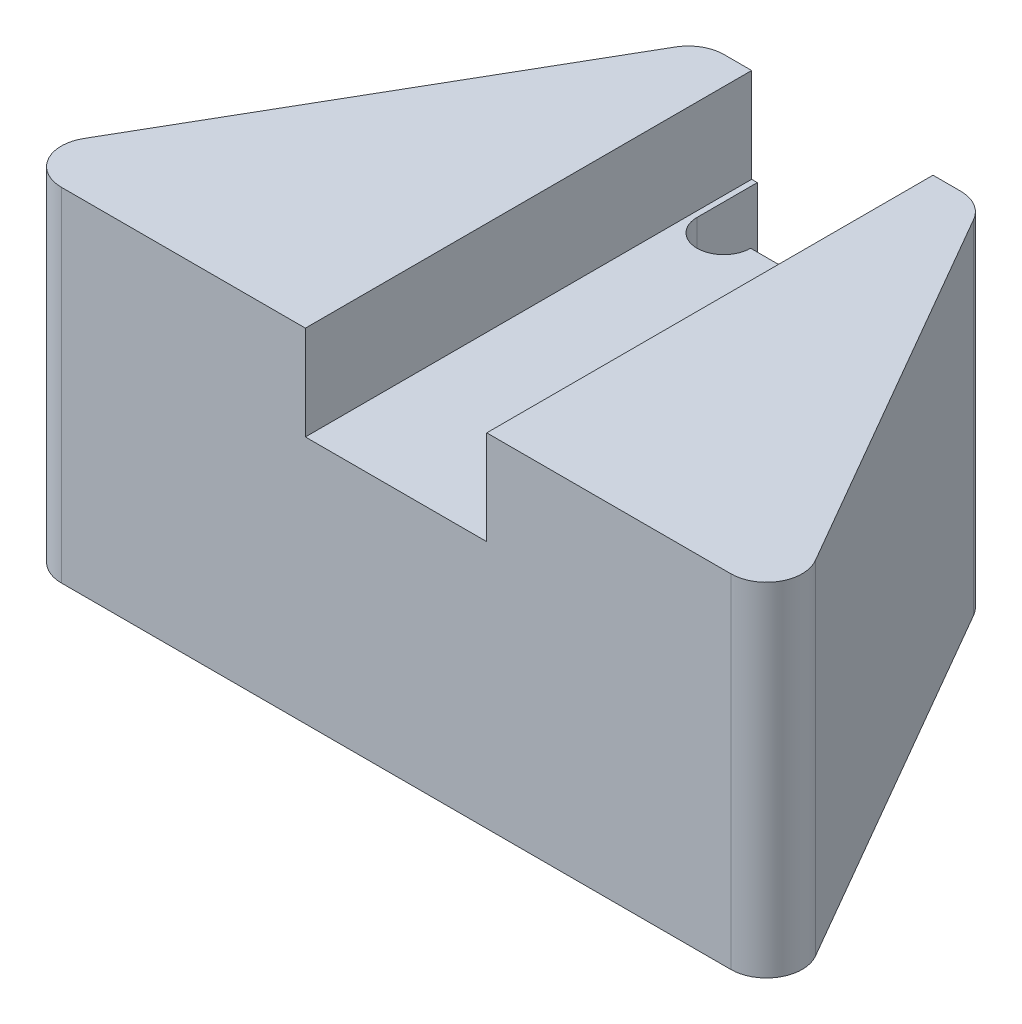
from build123d import *

# Parameters (mm, degrees)
BOSS_EXTRUDE1_DEPTH = 9.6
FILLET5_R           = 2
SKETCH7_W           = 10.16
SKETCH7_H           = 5.28
CUT_EXTRUDE6_DEPTH  = 34.879754173
SKETCH11_W          = 9.525
SKETCH11_H          = 9.525
CUT_EXTRUDE9_DEPTH  = 3.375
SKETCH12_R          = 1.5
CUT_EXTRUDE10_DEPTH = 9.525


with BuildPart() as part:
    # Sketch1 → Boss-Extrude1 (new, symmetric)
    with BuildSketch(Plane(origin=(0, 0, 0), x_dir=(1, 0, 0), z_dir=(0, 1, 0))):
        Polygon((-14.297771125, -12.5), (14.297771125, -12.5), (22.216878365, -12.5), (7.783121635, 12.5), (-7.783121635, 12.5), (-22.216878365, -12.5), align=None)
    extrude(amount=BOSS_EXTRUDE1_DEPTH, both=True)

    # Fillet5
    fillet5_edges = [part.edges().sort_by_distance(p)[0] for p in [
        (-22.216878365, 0, 12.5),
        (-7.783121635, 0, -12.5),
        (7.783121635, 0, -12.5),
        (22.216878365, 0, 12.5),
    ]]
    fillet(fillet5_edges, radius=FILLET5_R)

    # Sketch7 → Cut-Extrude6 (cut, through all)
    with BuildSketch(Plane.XY.offset(12.5)):
        with Locations((0, 6.96)):
            Rectangle(SKETCH7_W, SKETCH7_H)
    extrude(amount=-CUT_EXTRUDE6_DEPTH, mode=Mode.SUBTRACT)

    # Sketch11 → Cut-Extrude9 (cut)
    with BuildSketch(Plane(origin=(0, 0, -12.5), x_dir=(-1, 0, 0), z_dir=(0, 0, -1))):
        with Locations((0, -0.4425)):
            Rectangle(SKETCH11_W, SKETCH11_H)
    extrude(amount=-CUT_EXTRUDE9_DEPTH, mode=Mode.SUBTRACT)

    # Sketch12 → Cut-Extrude10 (cut)
    with BuildSketch(Plane(origin=(0, 4.32, 0), x_dir=(1, 0, 0), z_dir=(0, 1, 0))):
        with Locations((3.2625, 9.125)):
            Circle(SKETCH12_R)
        with Locations((-3.2625, 9.125)):
            Circle(SKETCH12_R)
    extrude(amount=-CUT_EXTRUDE10_DEPTH, mode=Mode.SUBTRACT)


solid = part.part
